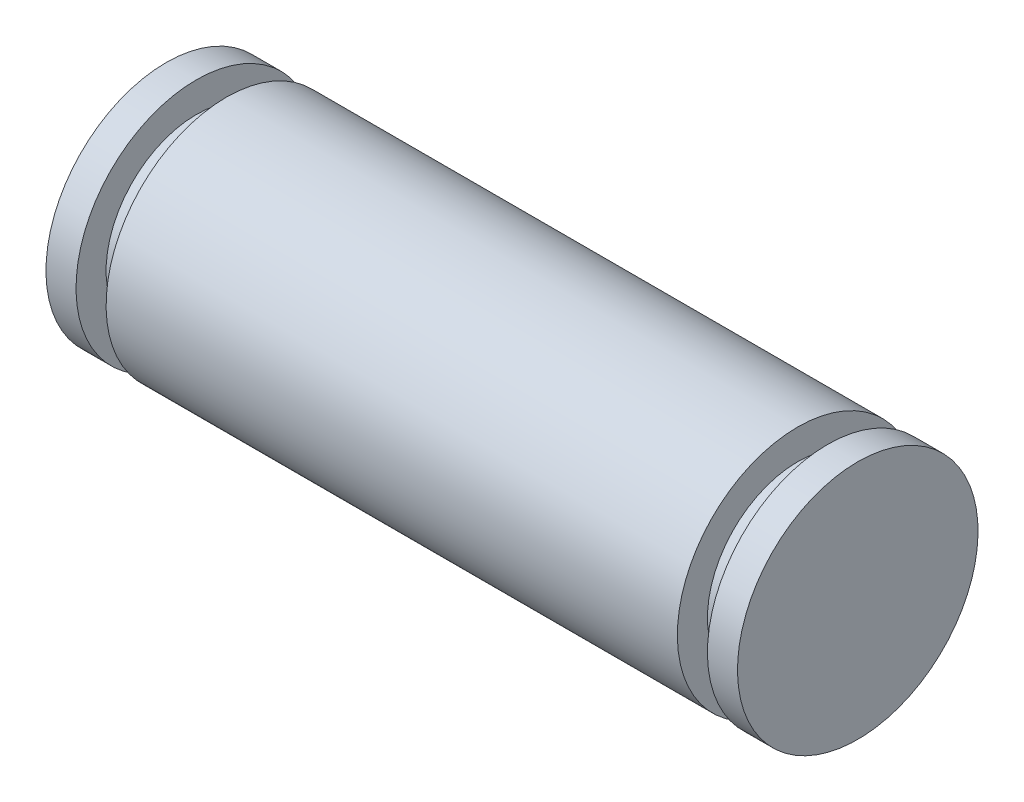
from build123d import *


with BuildPart() as part:
    # Esquisse1 → Révolution1 (revolve)
    with BuildSketch(Plane.XY):
        Polygon((-11.5, 0), (-11.5, 4), (-10.5, 4), (-10.5, 3), (-9.5, 3), (-9.5, 4), (9.5, 4), (9.5, 3), (10.5, 3), (10.5, 4), (11.5, 4), (11.5, 0), align=None)
    revolve(axis=Axis((11.5, 0, 0), (-1, 0, 0)))


solid = part.part
